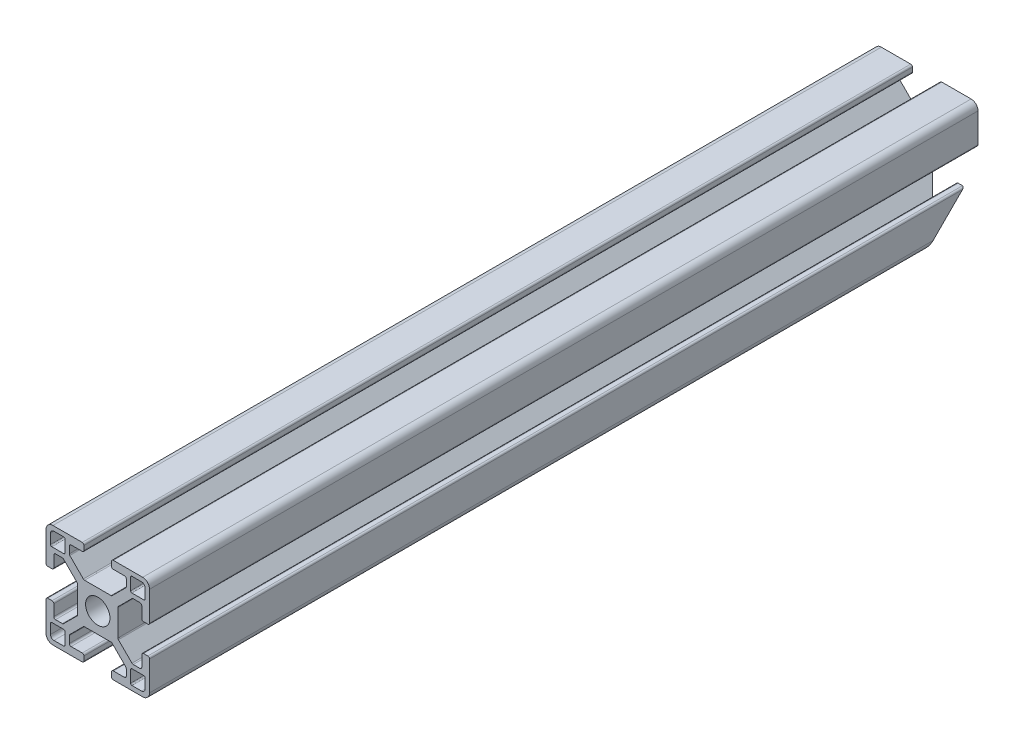
from build123d import *

# Parameters (mm, degrees)
SKETCH1_R           = 3.52998588
BOSS_EXTRUDE1_DEPTH = 120
SKETCH2_R           = 1.5
CUT_EXTRUDE1_DEPTH  = 13
CUT_EXTRUDE2_DEPTH  = 30


with BuildPart() as part:
    # Sketch1 → Boss-Extrude1 (new, symmetric)
    with BuildSketch(Plane.XY):
        with BuildLine():
            Line((14.49994, -4), (13.24247465, -4))
            ThreePointArc((13.24247465, -4), (12.88892126, -4.146446609), (12.74247465, -4.5))
            Line((12.74247465, -4.5), (12.74247465, -7.732519321))
            ThreePointArc((12.74247465, -7.732519321), (12.602449697, -8.097296796), (12.242781236, -8.249967))
            Line((12.242781236, -8.249967), (10.260188032, -8.249967))
            ThreePointArc((10.260188032, -8.249967), (10.068847082, -8.211906919), (9.906636056, -8.103520976))
            Line((9.906636056, -8.103520976), (5.981117769, -4.178002689))
            ThreePointArc((5.981117769, -4.178002689), (5.872731827, -4.015791664), (5.834671745, -3.824450713))
            Line((5.834671745, -3.824450713), (5.834671745, -1.01249595))
            Line((5.834671745, -1.01249595), (5.834671745, 0.88749645))
            Line((5.834671745, 0.88749645), (5.834671745, 3.824450713))
            ThreePointArc((5.834671745, 3.824450713), (5.872731827, 4.015791664), (5.981117769, 4.178002689))
            Line((5.981117769, 4.178002689), (9.906636056, 8.103520976))
            ThreePointArc((9.906636056, 8.103520976), (10.068847082, 8.211906919), (10.260188032, 8.249967))
            Line((10.260188032, 8.249967), (12.242781236, 8.249967))
            ThreePointArc((12.242781236, 8.249967), (12.602449697, 8.097296796), (12.74247465, 7.732519321))
            Line((12.74247465, 7.732519321), (12.74247465, 4.5))
            ThreePointArc((12.74247465, 4.5), (12.88892126, 4.146446609), (13.24247465, 4))
            Line((13.24247465, 4), (14.49994, 4))
            ThreePointArc((14.49994, 4), (14.853493391, 4.146446609), (14.99994, 4.5))
            Line((14.99994, 4.5), (14.99994, 12.999948))
            ThreePointArc((14.99994, 12.999948), (14.414155906, 14.414155906), (12.999948, 14.99994))
            Line((12.999948, 14.99994), (4.5, 14.99994))
            ThreePointArc((4.5, 14.99994), (4.146446609, 14.853493391), (4, 14.49994))
            Line((4, 14.49994), (4, 13.24247465))
            ThreePointArc((4, 13.24247465), (4.146446609, 12.88892126), (4.5, 12.74247465))
            Line((4.5, 12.74247465), (7.732519321, 12.74247465))
            ThreePointArc((7.732519321, 12.74247465), (8.097296796, 12.602449697), (8.249967, 12.242781236))
            Line((8.249967, 12.242781236), (8.249967, 10.260188032))
            ThreePointArc((8.249967, 10.260188032), (8.211906919, 10.068847082), (8.103520976, 9.906636056))
            Line((8.103520976, 9.906636056), (4.178002689, 5.981117769))
            ThreePointArc((4.178002689, 5.981117769), (4.015791664, 5.872731827), (3.824450713, 5.834671745))
            Line((3.824450713, 5.834671745), (0.9499962, 5.834671745))
            Line((0.9499962, 5.834671745), (-0.9499962, 5.834671745))
            Line((-0.9499962, 5.834671745), (-3.824450713, 5.834671745))
            ThreePointArc((-3.824450713, 5.834671745), (-4.015791664, 5.872731827), (-4.178002689, 5.981117769))
            Line((-4.178002689, 5.981117769), (-8.103520976, 9.906636056))
            ThreePointArc((-8.103520976, 9.906636056), (-8.211906919, 10.068847082), (-8.249967, 10.260188032))
            Line((-8.249967, 10.260188032), (-8.249967, 12.242781236))
            ThreePointArc((-8.249967, 12.242781236), (-8.097296796, 12.602449697), (-7.732519321, 12.74247465))
            Line((-7.732519321, 12.74247465), (-4.5, 12.74247465))
            ThreePointArc((-4.5, 12.74247465), (-4.146446609, 12.88892126), (-4, 13.24247465))
            Line((-4, 13.24247465), (-4, 14.49994))
            ThreePointArc((-4, 14.49994), (-4.146446609, 14.853493391), (-4.5, 14.99994))
            Line((-4.5, 14.99994), (-12.999948, 14.99994))
            ThreePointArc((-12.999948, 14.99994), (-14.414155906, 14.414155906), (-14.99994, 12.999948))
            Line((-14.99994, 12.999948), (-14.99994, 4.5))
            ThreePointArc((-14.99994, 4.5), (-14.853493391, 4.146446609), (-14.49994, 4))
            Line((-14.49994, 4), (-13.24247465, 4))
            ThreePointArc((-13.24247465, 4), (-12.88892126, 4.146446609), (-12.74247465, 4.5))
            Line((-12.74247465, 4.5), (-12.74247465, 7.732519321))
            ThreePointArc((-12.74247465, 7.732519321), (-12.602449697, 8.097296796), (-12.242781236, 8.249967))
            Line((-12.242781236, 8.249967), (-10.260188032, 8.249967))
            ThreePointArc((-10.260188032, 8.249967), (-10.068847082, 8.211906919), (-9.906636056, 8.103520976))
            Line((-9.906636056, 8.103520976), (-5.981117769, 4.178002689))
            ThreePointArc((-5.981117769, 4.178002689), (-5.872731827, 4.015791664), (-5.834671745, 3.824450713))
            Line((-5.834671745, 3.824450713), (-5.834671745, 0.88749645))
            Line((-5.834671745, 0.88749645), (-5.834671745, -1.01249595))
            Line((-5.834671745, -1.01249595), (-5.834671745, -3.824450713))
            ThreePointArc((-5.834671745, -3.824450713), (-5.872731827, -4.015791664), (-5.981117769, -4.178002689))
            Line((-5.981117769, -4.178002689), (-9.906636056, -8.103520976))
            ThreePointArc((-9.906636056, -8.103520976), (-10.068847082, -8.211906919), (-10.260188032, -8.249967))
            Line((-10.260188032, -8.249967), (-12.242781236, -8.249967))
            ThreePointArc((-12.242781236, -8.249967), (-12.602449697, -8.097296796), (-12.74247465, -7.732519321))
            Line((-12.74247465, -7.732519321), (-12.74247465, -4.5))
            ThreePointArc((-12.74247465, -4.5), (-12.88892126, -4.146446609), (-13.24247465, -4))
            Line((-13.24247465, -4), (-14.49994, -4))
            ThreePointArc((-14.49994, -4), (-14.853493391, -4.146446609), (-14.99994, -4.5))
            Line((-14.99994, -4.5), (-14.99994, -12.999948))
            ThreePointArc((-14.99994, -12.999948), (-14.414155906, -14.414155906), (-12.999948, -14.99994))
            Line((-12.999948, -14.99994), (-4.5, -14.99994))
            ThreePointArc((-4.5, -14.99994), (-4.146446609, -14.853493391), (-4, -14.49994))
            Line((-4, -14.49994), (-4, -13.24247465))
            ThreePointArc((-4, -13.24247465), (-4.146446609, -12.88892126), (-4.5, -12.74247465))
            Line((-4.5, -12.74247465), (-7.732519321, -12.74247465))
            ThreePointArc((-7.732519321, -12.74247465), (-8.097296796, -12.602449697), (-8.249967, -12.242781236))
            Line((-8.249967, -12.242781236), (-8.249967, -10.260188032))
            ThreePointArc((-8.249967, -10.260188032), (-8.211906919, -10.068847082), (-8.103520976, -9.906636056))
            Line((-8.103520976, -9.906636056), (-4.178002689, -5.981117769))
            ThreePointArc((-4.178002689, -5.981117769), (-4.015791664, -5.872731827), (-3.824450713, -5.834671745))
            Line((-3.824450713, -5.834671745), (-0.9499962, -5.834671745))
            Line((-0.9499962, -5.834671745), (0.9499962, -5.834671745))
            Line((0.9499962, -5.834671745), (3.824450713, -5.834671745))
            ThreePointArc((3.824450713, -5.834671745), (4.015791664, -5.872731827), (4.178002689, -5.981117769))
            Line((4.178002689, -5.981117769), (8.103520976, -9.906636056))
            ThreePointArc((8.103520976, -9.906636056), (8.211906919, -10.068847082), (8.249967, -10.260188032))
            Line((8.249967, -10.260188032), (8.249967, -12.242781236))
            ThreePointArc((8.249967, -12.242781236), (8.097296796, -12.602449697), (7.732519321, -12.74247465))
            Line((7.732519321, -12.74247465), (4.5, -12.74247465))
            ThreePointArc((4.5, -12.74247465), (4.146446609, -12.88892126), (4, -13.24247465))
            Line((4, -13.24247465), (4, -14.49994))
            ThreePointArc((4, -14.49994), (4.146446609, -14.853493391), (4.5, -14.99994))
            Line((4.5, -14.99994), (12.999948, -14.99994))
            ThreePointArc((12.999948, -14.99994), (14.414155906, -14.414155906), (14.99994, -12.999948))
            Line((14.99994, -12.999948), (14.99994, -4.5))
            ThreePointArc((14.99994, -4.5), (14.853493391, -4.146446609), (14.49994, -4))
        make_face()
        Circle(SKETCH1_R, mode=Mode.SUBTRACT)
        with BuildLine():
            Line((-12.6999492, -13.6999452), (-9.880960476, -13.6999452))
            ThreePointArc((-9.880960476, -13.6999452), (-9.61155387, -13.58835333), (-9.499962, -13.318946724))
            Line((-9.499962, -13.318946724), (-9.499962, -9.87996048))
            ThreePointArc((-9.499962, -9.87996048), (-9.611260978, -9.611260978), (-9.87996048, -9.499962))
            Line((-9.87996048, -9.499962), (-13.318946724, -9.499962))
            ThreePointArc((-13.318946724, -9.499962), (-13.58835333, -9.61155387), (-13.6999452, -9.880960476))
            Line((-13.6999452, -9.880960476), (-13.6999452, -12.6999492))
            ThreePointArc((-13.6999452, -12.6999492), (-13.407053153, -13.407053153), (-12.6999492, -13.6999452))
        make_face(mode=Mode.SUBTRACT)
        with BuildLine():
            Line((13.6999452, -12.6999492), (13.6999452, -9.880960476))
            ThreePointArc((13.6999452, -9.880960476), (13.58835333, -9.61155387), (13.318946724, -9.499962))
            Line((13.318946724, -9.499962), (9.87996048, -9.499962))
            ThreePointArc((9.87996048, -9.499962), (9.611260978, -9.611260978), (9.499962, -9.87996048))
            Line((9.499962, -9.87996048), (9.499962, -13.318946724))
            ThreePointArc((9.499962, -13.318946724), (9.61155387, -13.58835333), (9.880960476, -13.6999452))
            Line((9.880960476, -13.6999452), (12.6999492, -13.6999452))
            ThreePointArc((12.6999492, -13.6999452), (13.407053153, -13.407053153), (13.6999452, -12.6999492))
        make_face(mode=Mode.SUBTRACT)
        with BuildLine():
            Line((9.87996048, 9.499962), (13.318946724, 9.499962))
            ThreePointArc((13.318946724, 9.499962), (13.58835333, 9.61155387), (13.6999452, 9.880960476))
            Line((13.6999452, 9.880960476), (13.6999452, 12.6999492))
            ThreePointArc((13.6999452, 12.6999492), (13.407053153, 13.407053153), (12.6999492, 13.6999452))
            Line((12.6999492, 13.6999452), (9.880960476, 13.6999452))
            ThreePointArc((9.880960476, 13.6999452), (9.61155387, 13.58835333), (9.499962, 13.318946724))
            Line((9.499962, 13.318946724), (9.499962, 9.87996048))
            ThreePointArc((9.499962, 9.87996048), (9.611260978, 9.611260978), (9.87996048, 9.499962))
        make_face(mode=Mode.SUBTRACT)
        with BuildLine():
            Line((-13.6999452, 12.6999492), (-13.6999452, 9.880960476))
            ThreePointArc((-13.6999452, 9.880960476), (-13.58835333, 9.61155387), (-13.318946724, 9.499962))
            Line((-13.318946724, 9.499962), (-9.87996048, 9.499962))
            ThreePointArc((-9.87996048, 9.499962), (-9.611260978, 9.611260978), (-9.499962, 9.87996048))
            Line((-9.499962, 9.87996048), (-9.499962, 13.318946724))
            ThreePointArc((-9.499962, 13.318946724), (-9.61155387, 13.58835333), (-9.880960476, 13.6999452))
            Line((-9.880960476, 13.6999452), (-12.6999492, 13.6999452))
            ThreePointArc((-12.6999492, 13.6999452), (-13.407053153, 13.407053153), (-13.6999452, 12.6999492))
        make_face(mode=Mode.SUBTRACT)
    extrude(amount=BOSS_EXTRUDE1_DEPTH, both=True)

    # Sketch2 → Cut-Extrude1 (cut)
    with BuildSketch(Plane.ZY.offset(5.834671745)):
        with Locations((105, 0)):
            Circle(SKETCH2_R)
    extrude(amount=-CUT_EXTRUDE1_DEPTH, mode=Mode.SUBTRACT)

    # Sketch3 → Cut-Extrude2 (cut)
    with BuildSketch(Plane(origin=(14.99994, 0, 0), x_dir=(0, 0, -1), z_dir=(1, 0, 0))):
        Polygon((120, 0), (105.00006, -14.99994), (120, -14.99994), align=None)
    extrude(amount=-CUT_EXTRUDE2_DEPTH, mode=Mode.SUBTRACT)


solid = part.part
